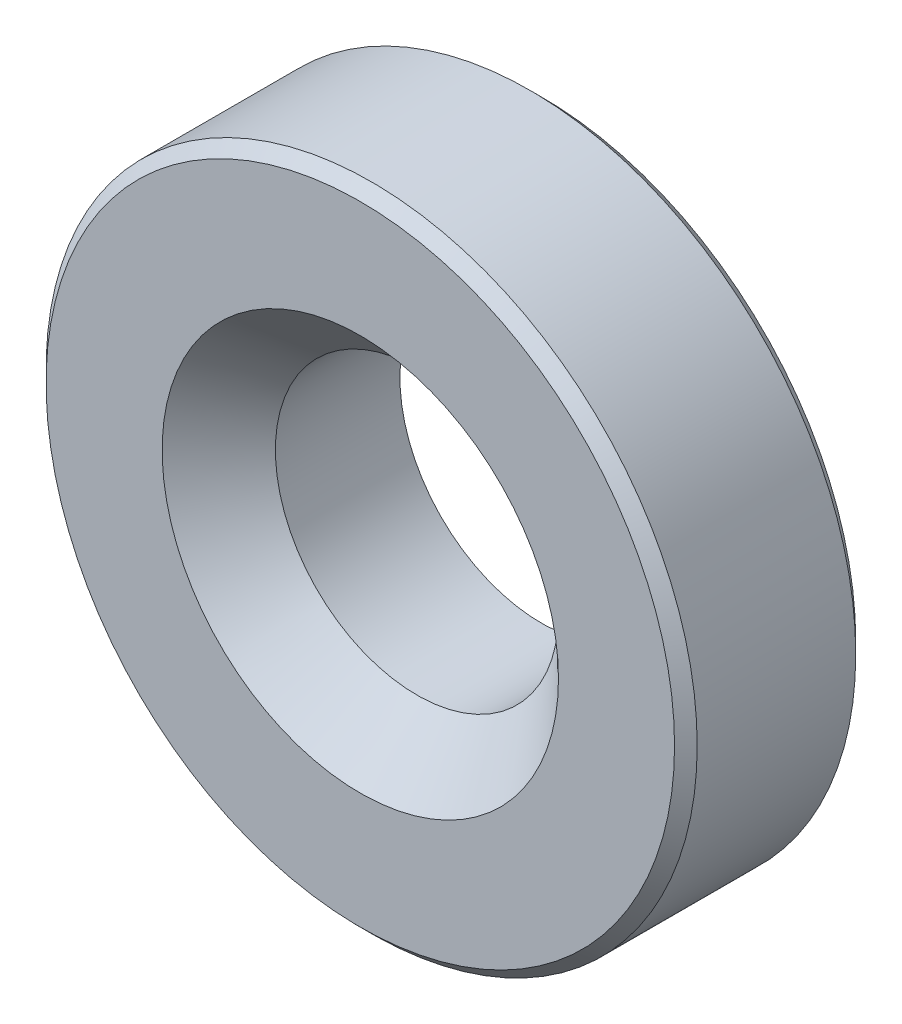
from build123d import *

# Parameters (mm, degrees)
SKETCH1_R           = 57.5
SKETCH1_R_2         = 25
BOSS_EXTRUDE1_DEPTH = 16
CHAMFER1_SIZE       = 2
CHAMFER2_SIZE       = 10


with BuildPart() as part:
    # Sketch1 → Boss-Extrude1 (new, symmetric)
    with BuildSketch(Plane.XY):
        Circle(SKETCH1_R)
        Circle(SKETCH1_R_2, mode=Mode.SUBTRACT)
    extrude(amount=BOSS_EXTRUDE1_DEPTH, both=True)

    # Chamfer1
    chamfer1_edges = [part.edges().sort_by_distance(p)[0] for p in [
        (-57.5, 0, -16),
        (-57.5, 0, 16),
    ]]
    chamfer(chamfer1_edges, length=CHAMFER1_SIZE)

    # Chamfer2
    chamfer2_edges = [part.edges().sort_by_distance(p)[0] for p in [
        (-25, 0, 16),
    ]]
    chamfer(chamfer2_edges, length=CHAMFER2_SIZE)


solid = part.part
